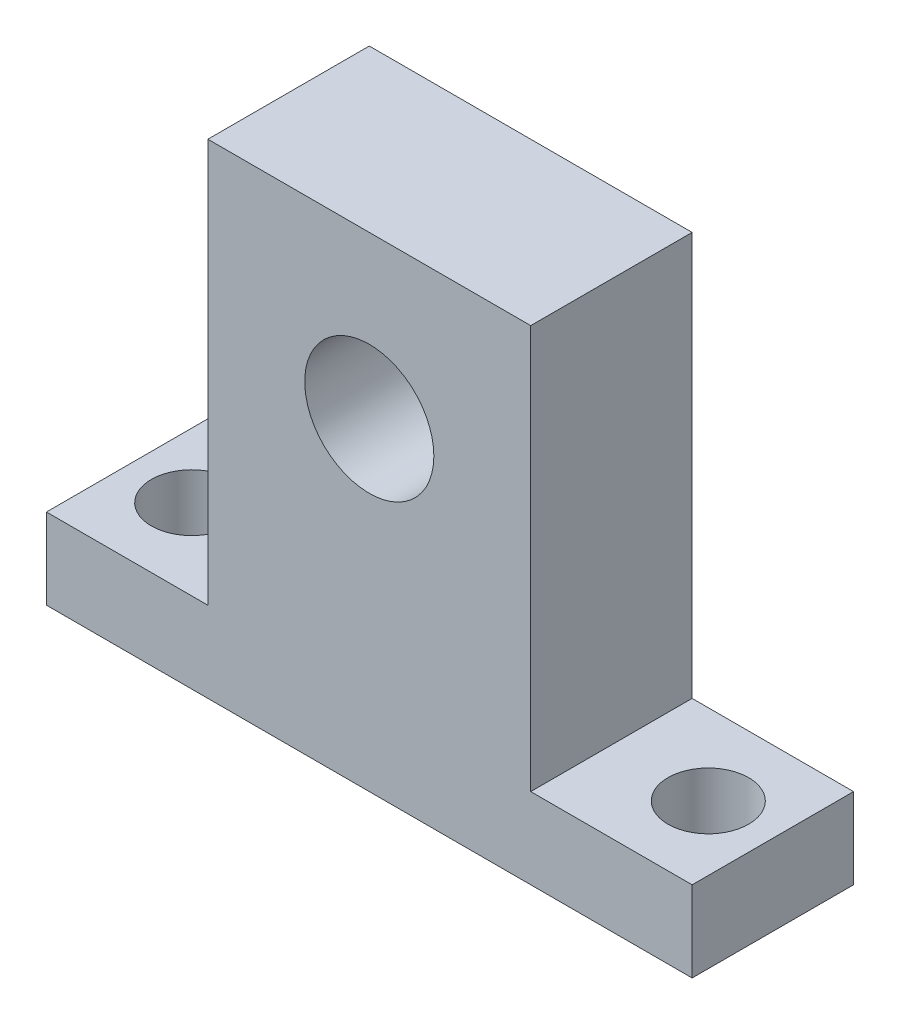
from build123d import *

# Parameters (mm, degrees)
RESSALTO_EXTRUS_O1_DEPTH      = 5
RESSALTO_EXTRUS_O1_DEPTH_BACK = 5
CORTE_EXTRUS_O1_DEPTH         = 5
CORTE_EXTRUS_O1_DEPTH_BACK    = 5
ESBO_O2_R                     = 4
ESBO_O3_R                     = 2.5
CORTE_EXTRUS_O2_DEPTH         = 29.722813233


with BuildPart() as part:
    # Esboço1 → Ressalto-extrusão1 (new, two sides: drawn at the far end of the back side and taken through both)
    with BuildSketch(Plane.XY.offset(-RESSALTO_EXTRUS_O1_DEPTH_BACK)):
        Polygon((-10, 10), (-10, -15), (-20, -15), (-20, -20), (20, -20), (20, -15), (10, -15), (10, 10), align=None)
    extrude(amount=RESSALTO_EXTRUS_O1_DEPTH + RESSALTO_EXTRUS_O1_DEPTH_BACK)

    # Esboço2 → Corte-extrusão1 (cut, two sides: drawn at the far end of the back side and taken through both)
    with BuildSketch(Plane.XY.offset(-CORTE_EXTRUS_O1_DEPTH_BACK)):
        Circle(ESBO_O2_R)
    extrude(amount=CORTE_EXTRUS_O1_DEPTH + CORTE_EXTRUS_O1_DEPTH_BACK, mode=Mode.SUBTRACT)

    # Esboço3 → Corte-extrusão2 (cut, through all)
    with BuildSketch(Plane(origin=(0, 0, 0), x_dir=(1, 0, 0), z_dir=(0, 1, 0))):
        with Locations((-16, 0)):
            Circle(ESBO_O3_R)
        with Locations((16, 0)):
            Circle(ESBO_O3_R)
    extrude(amount=-CORTE_EXTRUS_O2_DEPTH, mode=Mode.SUBTRACT)


solid = part.part
